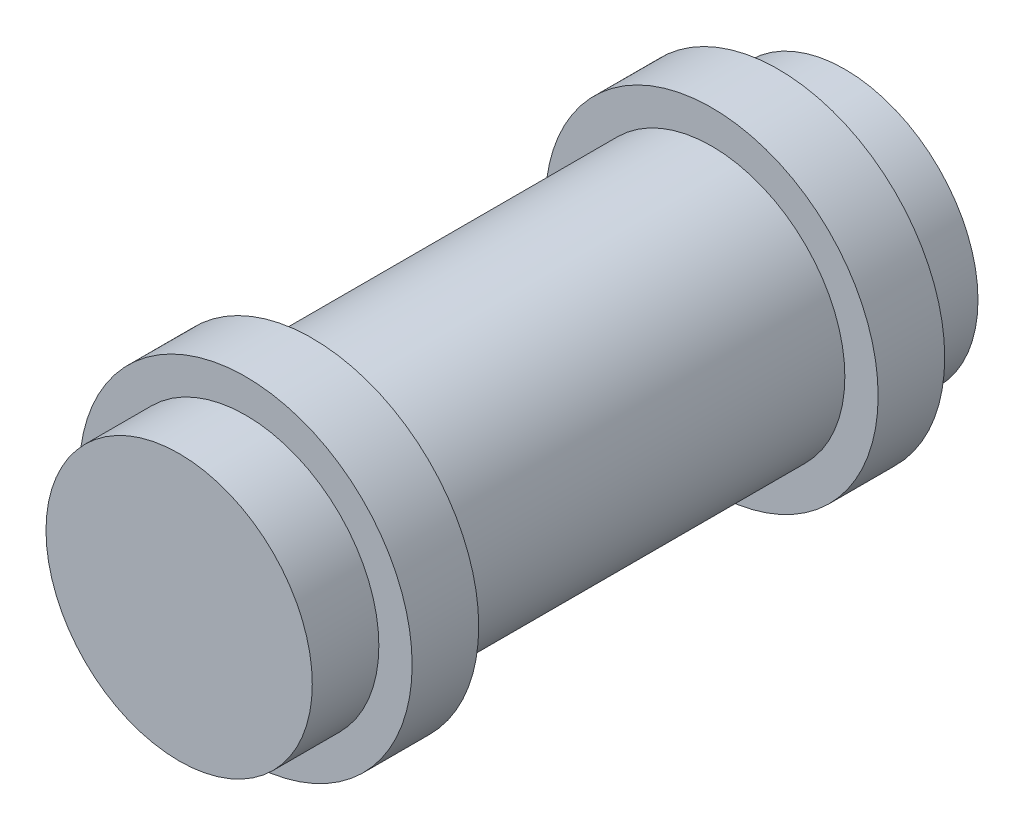
from build123d import *

# Parameters (mm, degrees)
SKETCH1_R           = 10
BOSS_EXTRUDE1_DEPTH = 50
BOSS_EXTRUDE2_START = -5
SKETCH2_R           = 12.5
BOSS_EXTRUDE2_DEPTH = 5


with BuildPart() as part:
    # Sketch1 → Boss-Extrude1 (new body)
    with BuildSketch(Plane.XY):
        Circle(SKETCH1_R)
    extrude(amount=BOSS_EXTRUDE1_DEPTH)

    # Sketch2 → Boss-Extrude2 (add)
    with BuildSketch(Plane.XY.offset(50).offset(BOSS_EXTRUDE2_START)):
        Circle(SKETCH2_R)
    boss_extrude2 = extrude(amount=-BOSS_EXTRUDE2_DEPTH)

    # Mirror1: Boss-Extrude2 across plane
    add(boss_extrude2.mirror(Plane.XY.offset(25)))


solid = part.part
